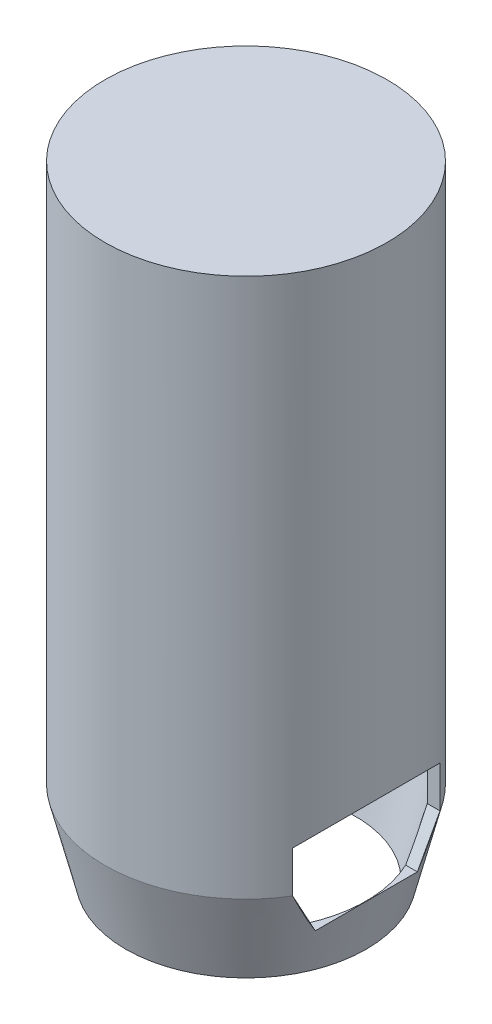
from build123d import *

# Parameters (mm, degrees)
SKETCH3_R               = 68
BOSS_EXTRUDE1_DEPTH     = 300
SHELL1_T                = -5
CUT_EXTRUDE1_DEPTH      = 316.036505821
CUT_EXTRUDE1_DEPTH_BACK = 316.036505821
CUT_EXTRUDE2_START      = -116
CUT_EXTRUDE2_DEPTH      = 116


with BuildPart() as part:
    # Sketch3 → Boss-Extrude1 (new body)
    with BuildSketch(Plane(origin=(0, 0, 0), x_dir=(1, 0, 0), z_dir=(0, 1, 0))):
        with Locations(Location((0, 0, 0), (0, 0, 270))):
            Circle(SKETCH3_R)
    extrude(amount=BOSS_EXTRUDE1_DEPTH)

    # Sketch5 → Cut-Revolve1 (revolve, cut)
    with BuildSketch(Plane.XY, mode=Mode.PRIVATE) as cut_revolve1_sk:
        Polygon((-58, 0), (-68, 0), (-68, 40), align=None)
    revolve(cut_revolve1_sk.sketch.rotate(Axis((0, 300, 0), (0, -1, 0)), 270), axis=Axis((0, 300, 0), (0, -1, 0)), mode=Mode.SUBTRACT)

    # Shell1
    shell1_openings = [part.faces().sort_by_distance(p)[0] for p in [
        (0, 0, 0),
    ]]
    offset(amount=SHELL1_T, openings=shell1_openings, kind=Kind.INTERSECTION)

    # Sketch6 → Cut-Extrude1 (cut, two sides: drawn at the far end of the back side and taken through both)
    with BuildSketch(Plane.XY.offset(-CUT_EXTRUDE1_DEPTH_BACK)):
        Polygon((-68, 70), (-68, 30), (-58, 20), (-58, 60), align=None)
        Polygon((68, 30), (58, 20), (58, 60), (68, 70), align=None)
    extrude(amount=CUT_EXTRUDE1_DEPTH + CUT_EXTRUDE1_DEPTH_BACK, mode=Mode.SUBTRACT)

    # Sketch7 → Cut-Extrude2 (cut)
    with BuildSketch(Plane.ZY.offset(58).offset(CUT_EXTRUDE2_START)):
        Polygon((-35.496478699, 60), (35.496478699, 60), (35.496478699, 40), (24.596747752, 20), (-24.596747752, 20), (-35.496478699, 40), align=None)
    extrude(amount=CUT_EXTRUDE2_DEPTH, mode=Mode.SUBTRACT)


solid = part.part
